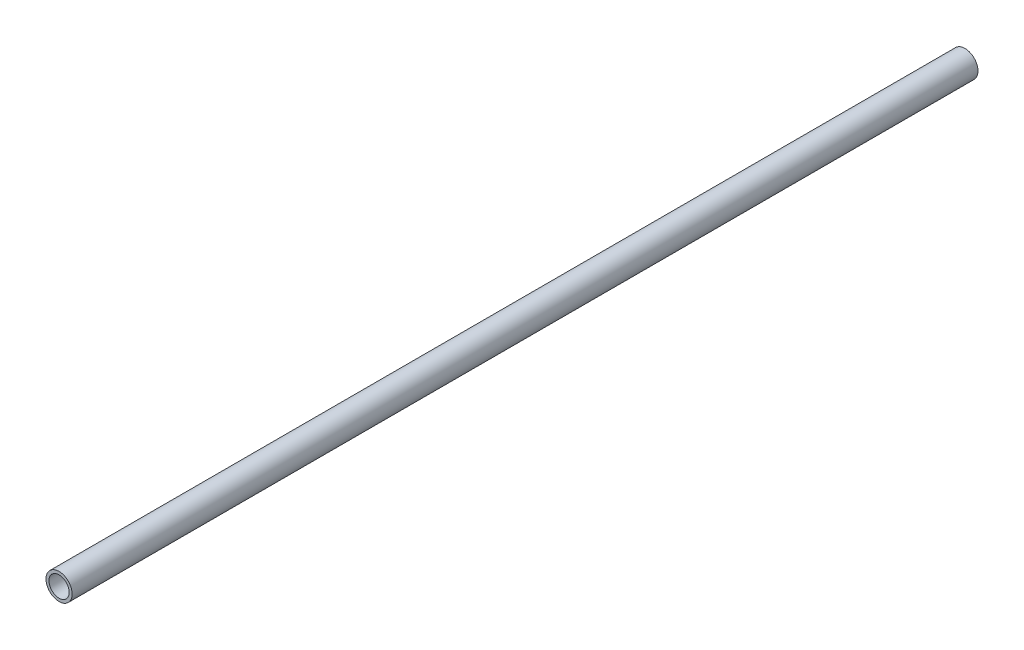
from build123d import *

# Parameters (mm, degrees)
SKETCH1_R           = 4.7625
SKETCH1_R_2         = 3.683
BOSS_EXTRUDE1_DEPTH = 165.1


with BuildPart() as part:
    # Sketch1 → Boss-Extrude1 (new, symmetric)
    with BuildSketch(Plane.XY):
        Circle(SKETCH1_R)
        Circle(SKETCH1_R_2, mode=Mode.SUBTRACT)
    extrude(amount=BOSS_EXTRUDE1_DEPTH, both=True)


solid = part.part
